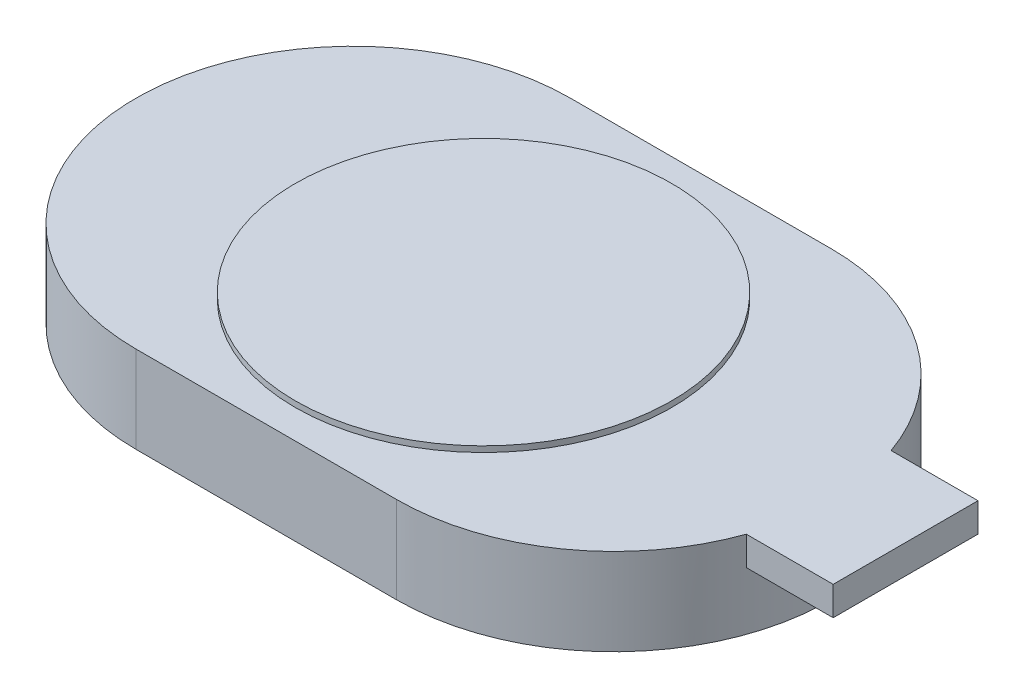
from build123d import *

# Parameters (mm, degrees)
EXTRUDE_1_DEPTH = 3
SKETCH_2_R      = 6.5
EXTRUDE_2_DEPTH = 0.2
SKETCH_4_W      = 3
SKETCH_4_H      = 5
EXTRUDE_3_DEPTH = 1


with BuildPart() as part:
    # 草图1 → 凸台-拉伸1 (new body)
    with BuildSketch(Plane(origin=(0, 0, 0), x_dir=(1, 0, 0), z_dir=(0, 1, 0))):
        with BuildLine():
            Line((-4.5, 7.5), (4.5, 7.5))
            ThreePointArc((4.5, 7.5), (12, 0), (4.5, -7.5))
            Line((4.5, -7.5), (-4.5, -7.5))
            ThreePointArc((-4.5, -7.5), (-12, 0), (-4.5, 7.5))
        make_face()
    extrude(amount=EXTRUDE_1_DEPTH)

    # 草图2 → 凸台-拉伸2 (add)
    with BuildSketch(Plane(origin=(0, 3, 0), x_dir=(1, 0, 0), z_dir=(0, 1, 0))):
        with Locations(Location((0, 0, 0), (0, 0, 270))):
            Circle(SKETCH_2_R)
    extrude(amount=EXTRUDE_2_DEPTH)

    # 草图4 → 凸台-拉伸3 (add)
    with BuildSketch(Plane(origin=(0, 3, 0), x_dir=(1, 0, 0), z_dir=(0, 1, 0))):
        with Locations((13.071067812, 0)):
            Rectangle(SKETCH_4_W, SKETCH_4_H)
    extrude(amount=-EXTRUDE_3_DEPTH)


solid = part.part
